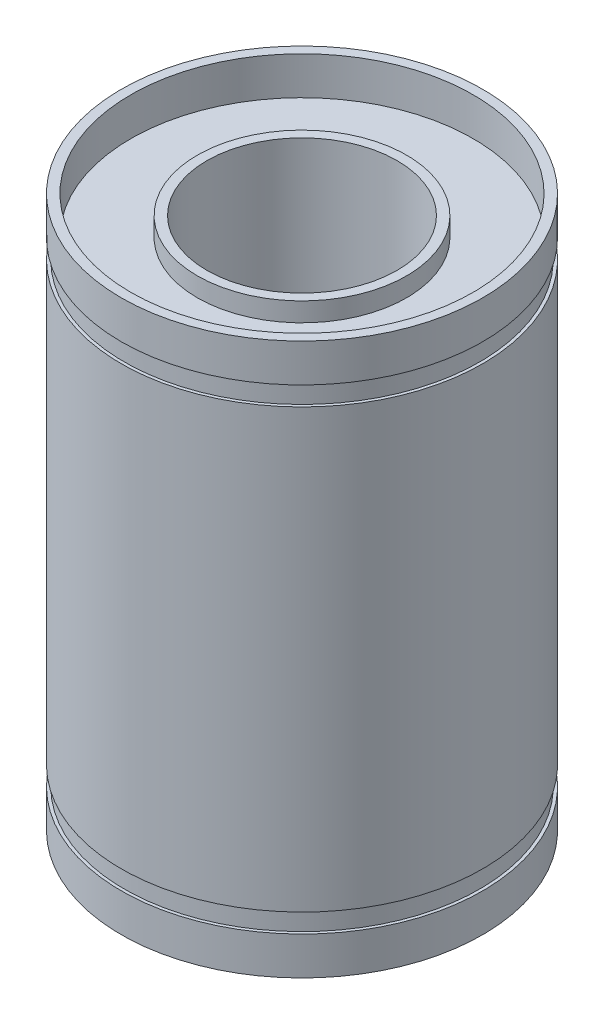
from build123d import *

# Parameters (mm, degrees)
SKETCH1_R            = 5.484091061
SKETCH1_R_2          = 5
BOSS_EXTRUDE1_DEPTH  = 6
SKETCH2_R            = 9.5
SKETCH2_R_2          = 9
BOSS_EXTRUDE2_DEPTH  = 2
SKETCH3_R            = 9.341445955
BOSS_EXTRUDE5_DEPTH  = 6
SKETCH4_R            = 9.341445955
CUT_EXTRUDE1_DEPTH   = 5
BOSS_EXTRUDE7_START  = 23
SKETCH5_R            = 9.5
BOSS_EXTRUDE7_DEPTH  = 23
BOSS_EXTRUDE8_START  = 1
SKETCH7_R            = 9.341445955
BOSS_EXTRUDE8_DEPTH  = 1
BOSS_EXTRUDE9_START  = 2
SKETCH8_R            = 9.5
BOSS_EXTRUDE9_DEPTH  = 2
SKETCH9_R            = 5
CUT_EXTRUDE2_DEPTH   = 29
SKETCH10_R           = 9
SKETCH10_R_2         = 5
CUT_EXTRUDE3_DEPTH   = 2
SKETCH11_R           = 5.5
SKETCH11_R_2         = 5
BOSS_EXTRUDE10_DEPTH = 1
BOSS_EXTRUDE11_START = 1
SKETCH12_R           = 5.5
SKETCH12_R_2         = 5
BOSS_EXTRUDE11_DEPTH = 1


with BuildPart() as part:
    # Sketch1 → Boss-Extrude1 (new body)
    with BuildSketch(Plane(origin=(0, 0, 0), x_dir=(1, 0, 0), z_dir=(0, 1, 0))):
        with Locations(Location((0, 0, 0), (0, 0, 270))):
            Circle(SKETCH1_R)
        with Locations(Location((0, 0, 0), (0, 0, 270))):
            Circle(SKETCH1_R_2, mode=Mode.SUBTRACT)
    extrude(amount=BOSS_EXTRUDE1_DEPTH)



with BuildPart() as body_2:
    # Sketch2 → Boss-Extrude2 (new body)
    with BuildSketch(Plane(origin=(0, 6, 0), x_dir=(1, 0, 0), z_dir=(0, 1, 0))):
        with Locations(Location((0, 0, 0), (0, 0, 270))):
            Circle(SKETCH2_R)
        with Locations(Location((0, 0, 0), (0, 0, 270))):
            Circle(SKETCH2_R_2, mode=Mode.SUBTRACT)
    extrude(amount=BOSS_EXTRUDE2_DEPTH)


with BuildPart() as part_1:
    add(part.part)

    add(body_2.part)  # Boss-Extrude5 merges body 2
    # Sketch3 → Boss-Extrude5 (add)
    with BuildSketch(Plane.XZ):
        with Locations(Location((0, 0, 0), (0, 0, 270))):
            Circle(SKETCH3_R)
    extrude(amount=-BOSS_EXTRUDE5_DEPTH)

    # Sketch4 → Cut-Extrude1 (cut)
    with BuildSketch(Plane.XZ):
        with Locations(Location((0, 0, 0), (0, 0, 270))):
            Circle(SKETCH4_R)
    extrude(amount=-CUT_EXTRUDE1_DEPTH, mode=Mode.SUBTRACT)

    # Sketch5 → Boss-Extrude7 (add)
    with BuildSketch(Plane.XZ.offset(-5).offset(BOSS_EXTRUDE7_START)):
        with Locations(Location((0, 0, 0), (0, 0, 90))):
            Circle(SKETCH5_R)
    extrude(amount=-BOSS_EXTRUDE7_DEPTH)

    # Sketch7 → Boss-Extrude8 (add)
    with BuildSketch(Plane.XZ.offset(18).offset(BOSS_EXTRUDE8_START)):
        with Locations(Location((0, 0, 0), (0, 0, 270))):
            Circle(SKETCH7_R)
    extrude(amount=-BOSS_EXTRUDE8_DEPTH)

    # Sketch8 → Boss-Extrude9 (add)
    with BuildSketch(Plane.XZ.offset(19).offset(BOSS_EXTRUDE9_START)):
        with Locations(Location((0, 0, 0), (0, 0, 90))):
            Circle(SKETCH8_R)
    extrude(amount=-BOSS_EXTRUDE9_DEPTH)

    # Sketch9 → Cut-Extrude2 (cut)
    with BuildSketch(Plane.XZ.offset(21)):
        with Locations(Location((0, 0, 0), (0, 0, 270))):
            Circle(SKETCH9_R)
    extrude(amount=-CUT_EXTRUDE2_DEPTH, mode=Mode.SUBTRACT)

    # Sketch10 → Cut-Extrude3 (cut)
    with BuildSketch(Plane.XZ.offset(21)):
        with Locations(Location((0, 0, 0), (0, 0, 90))):
            Circle(SKETCH10_R)
        with Locations(Location((0, 0, 0), (0, 0, 270))):
            Circle(SKETCH10_R_2, mode=Mode.SUBTRACT)
    extrude(amount=-CUT_EXTRUDE3_DEPTH, mode=Mode.SUBTRACT)

    # Sketch11 → Boss-Extrude10 (add)
    with BuildSketch(Plane(origin=(0, 6, 0), x_dir=(1, 0, 0), z_dir=(0, 1, 0))):
        with Locations(Location((0, 0, 0), (0, 0, 270))):
            Circle(SKETCH11_R)
        with Locations(Location((0, 0, 0), (0, 0, 90))):
            Circle(SKETCH11_R_2, mode=Mode.SUBTRACT)
    extrude(amount=BOSS_EXTRUDE10_DEPTH)

    # Sketch12 → Boss-Extrude11 (add)
    with BuildSketch(Plane.XZ.offset(19).offset(BOSS_EXTRUDE11_START)):
        with Locations(Location((0, 0, 0), (0, 0, 90))):
            Circle(SKETCH12_R)
        with Locations(Location((0, 0, 0), (0, 0, 270))):
            Circle(SKETCH12_R_2, mode=Mode.SUBTRACT)
    extrude(amount=-BOSS_EXTRUDE11_DEPTH)


solid = part_1.part
